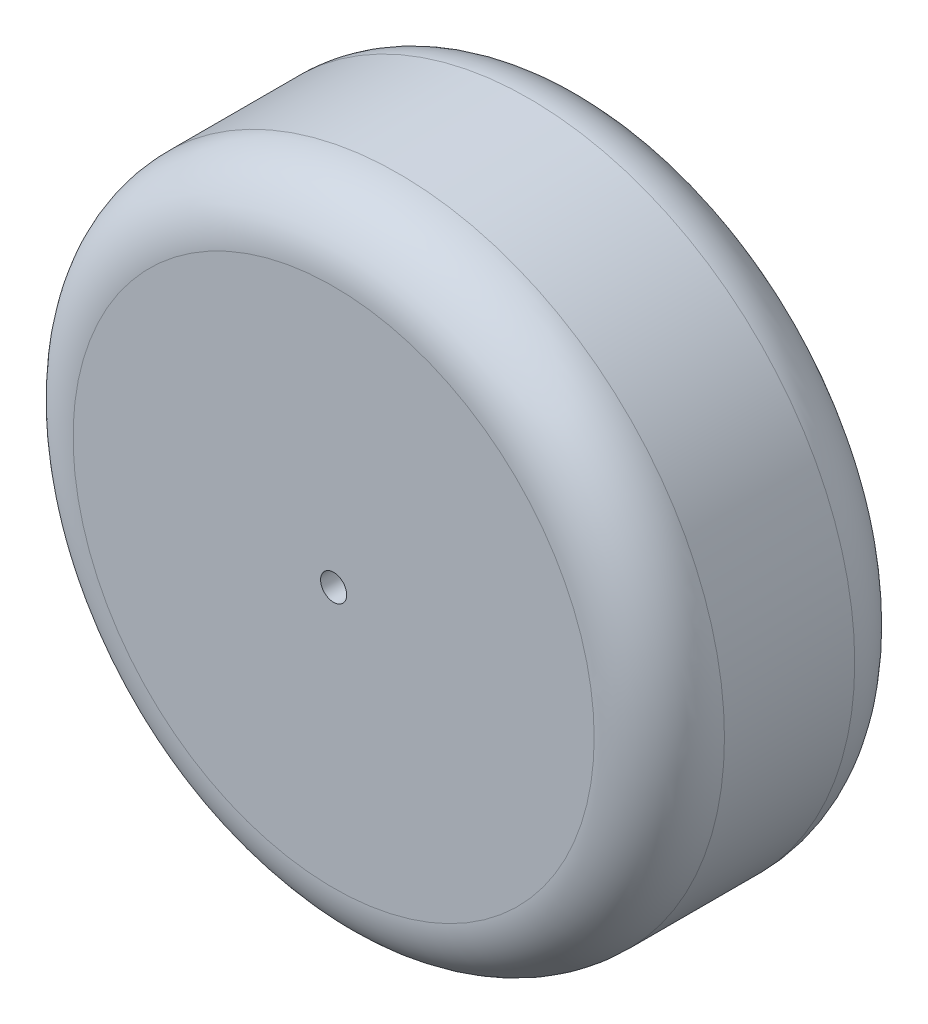
from build123d import *

# Parameters (mm, degrees)
SKETCH1_R           = 25
BOSS_EXTRUDE1_DEPTH = 20
SKETCH2_R           = 1
CUT_EXTRUDE1_DEPTH  = 6
FILLET1_R           = 5


with BuildPart() as part:
    # Sketch1 → Boss-Extrude1 (new body)
    with BuildSketch(Plane.XY):
        Circle(SKETCH1_R)
    extrude(amount=BOSS_EXTRUDE1_DEPTH)

    # Sketch2 → Cut-Extrude1 (cut)
    with BuildSketch(Plane.XY.offset(20)):
        Circle(SKETCH2_R)
    extrude(amount=-CUT_EXTRUDE1_DEPTH, mode=Mode.SUBTRACT)

    # Fillet1
    fillet1_edges = [part.edges().sort_by_distance(p)[0] for p in [
        (-25, 0, 0),
        (-25, 0, 20),
    ]]
    fillet(fillet1_edges, radius=FILLET1_R)


solid = part.part
